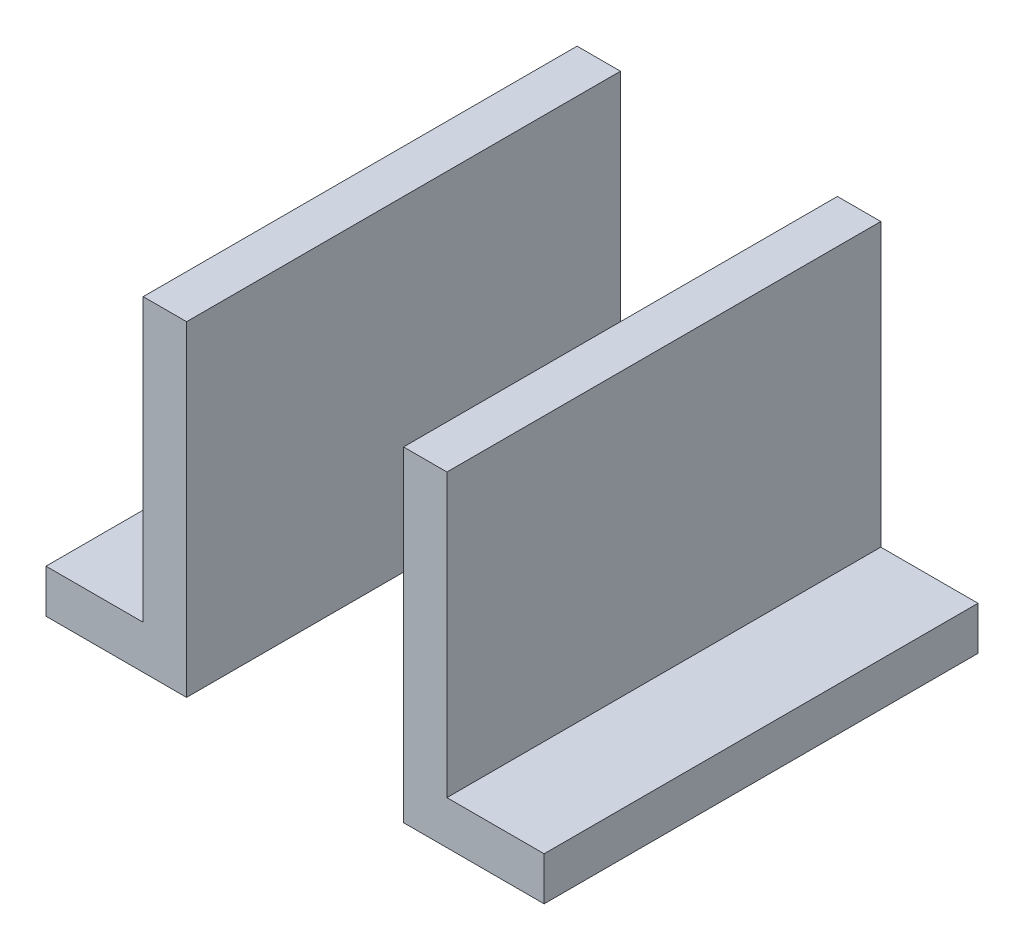
from build123d import *

# Parameters (mm, degrees)
BOSS_EXTRUDE1_DEPTH   = 100
BOSS_EXTRUDE1_2_DEPTH = 100


with BuildPart() as part:
    # Sketch1 → Boss-Extrude1 (new body)
    with BuildSketch(Plane.XY):
        Polygon((-57.404010399, -45.485546177), (-25, -45.485546177), (-25, 29.514453823), (-35, 29.514453823), (-35, -35.485546177), (-57.404010399, -35.485546177), align=None)
    extrude(amount=BOSS_EXTRUDE1_DEPTH)


with BuildPart() as body_2:
    # Sketch1 → Boss-Extrude1 2 (new body)
    with BuildSketch(Plane.XY):
        Polygon((25, 29.514453823), (35, 29.514453823), (35, -35.485546177), (57.404010399, -35.485546177), (57.404010399, -45.485546177), (25, -45.485546177), align=None)
    extrude(amount=BOSS_EXTRUDE1_2_DEPTH)


solid = Compound([part.part, body_2.part])
